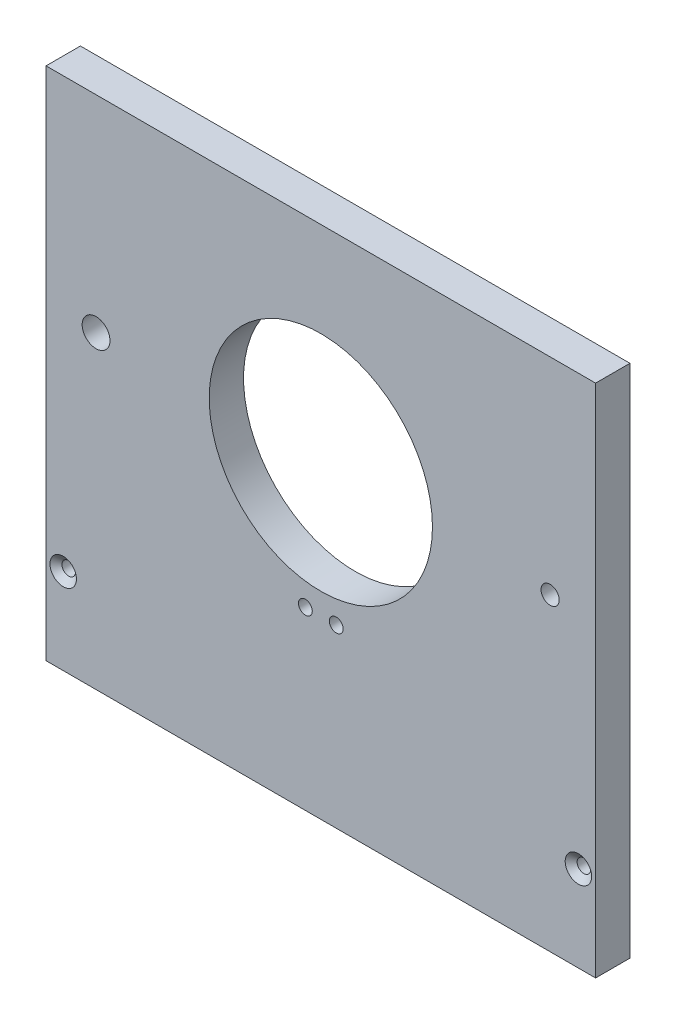
from build123d import *

# Parameters (mm, degrees)
SKETCH1_W                                          = 203.2
SKETCH1_H                                          = 190.5
BOSS_EXTRUDE1_DEPTH                                = 12.7
SKETCH2_R                                          = 41.275
SKETCH2_R_2                                        = 5.1435
SKETCH2_R_3                                        = 3.3655
CUT_EXTRUDE1_DEPTH                                 = 140.844243714
F_10_32_TAPPED_HOLE1_D                             = 4.0386
F_10_32_TAPPED_HOLE1_DEPTH                         = 25.4
F_10_32_TAPPED_HOLE1_TIP                           = 1.213317848
CSK_FOR_10_FLAT_HEAD_MACHINE_SCREW_100_D           = 4.9784
CSK_FOR_10_FLAT_HEAD_MACHINE_SCREW_100_CSINK_D     = 9.779
CSK_FOR_10_FLAT_HEAD_MACHINE_SCREW_100_CSINK_ANGLE = 100
F_7_0_201_DIAMETER_HOLE1_D                         = 5.1054


with BuildPart() as part:
    # Sketch1 → Boss-Extrude1 (new body)
    with BuildSketch(Plane.XY):
        Rectangle(SKETCH1_W, SKETCH1_H)
    extrude(amount=BOSS_EXTRUDE1_DEPTH)

    # Sketch2 → Cut-Extrude1 (cut, through all)
    with BuildSketch(Plane.XY.offset(12.7)):
        with Locations((0, 19.05)):
            Circle(SKETCH2_R)
        with Locations((-83.109250243, 19.05)):
            Circle(SKETCH2_R_2)
        with Locations((84.784749757, 19.05)):
            Circle(SKETCH2_R_3)
    extrude(amount=-CUT_EXTRUDE1_DEPTH, mode=Mode.SUBTRACT)

    # #10-32 Tapped Hole1
    with Locations(Plane(origin=(0, -95.25, 0), x_dir=(-1, 0, 0), z_dir=(0, -1, 0))):
        with Locations((82.55, -6.35), (0, -6.35), (-82.55, -6.35)):
            Hole(F_10_32_TAPPED_HOLE1_D / 2, depth=F_10_32_TAPPED_HOLE1_DEPTH)
            with Locations((0, 0, -(F_10_32_TAPPED_HOLE1_DEPTH + F_10_32_TAPPED_HOLE1_TIP / 2))):  # 118° drill point
                Cone(0, F_10_32_TAPPED_HOLE1_D / 2, F_10_32_TAPPED_HOLE1_TIP, mode=Mode.SUBTRACT)

    # CSK for #10 Flat Head Machine Screw (100)1 (through all)
    with Locations(Plane.XY.offset(12.7)):
        with Locations((-95.25, -63.5), (95.25, -63.5)):
            CounterSinkHole(CSK_FOR_10_FLAT_HEAD_MACHINE_SCREW_100_D / 2, CSK_FOR_10_FLAT_HEAD_MACHINE_SCREW_100_CSINK_D / 2, counter_sink_angle=CSK_FOR_10_FLAT_HEAD_MACHINE_SCREW_100_CSINK_ANGLE)

    # #7 (0.201) Diameter Hole1 (through all)
    with Locations(Plane.XY.offset(12.7)):
        with Locations((-5.715, -30.1625), (5.715, -30.1625)):
            Hole(F_7_0_201_DIAMETER_HOLE1_D / 2)


solid = part.part
